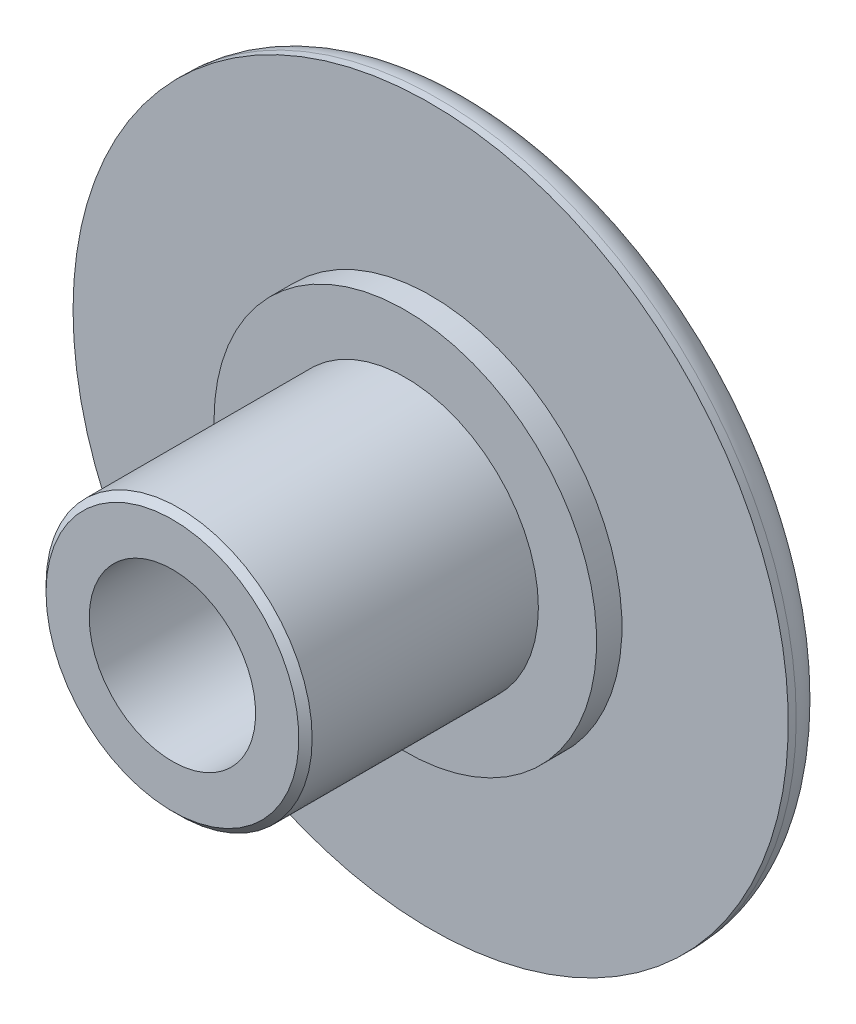
from build123d import *

# Parameters (mm, degrees)
CHAMFER3_SIZE = 0.2
FILLET2_R     = 1


with BuildPart() as part:
    # Sketch1 → Revolve1 (revolve)
    with BuildSketch(Plane(origin=(0, 0, 0), x_dir=(1, 0, 0), z_dir=(0, 1, 0)), mode=Mode.PRIVATE) as revolve1_sk:
        Polygon((4, 0), (2.5, 0), (2.5, 6), (0, 6), (0, 9), (10.75, 9), (10.75, 7.762245205), (5.75, 7.762245205), (5.75, 7), (4, 7), align=None)
    revolve(revolve1_sk.sketch.rotate(Axis((0, 0, -9.865928584), (0, 0, 1)), 180), axis=Axis((0, 0, -9.865928584), (0, 0, 1)))

    # Chamfer3
    chamfer3_edges = [part.edges().sort_by_distance(p)[0] for p in [
        (4, 0, 0),
    ]]
    chamfer(chamfer3_edges, length=CHAMFER3_SIZE)

    # Fillet2
    fillet2_edges = [part.edges().sort_by_distance(p)[0] for p in [
        (10.75, 0, -9),
    ]]
    fillet(fillet2_edges, radius=FILLET2_R)


solid = part.part
